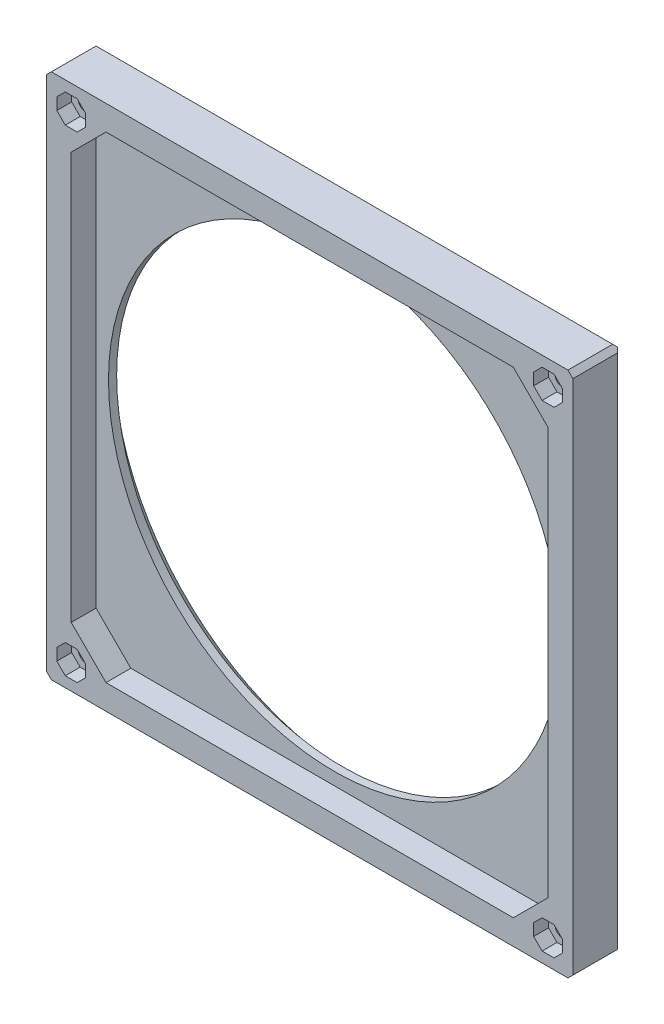
from build123d import *

# Parameters (mm, degrees)
SKETCH1_LARGER_DIA_W    = 106
SKETCH1_LARGER_DIA_H    = 106
BOSS_EXTRUDE1_DEPTH     = 5
SKETCH5_SMALLER_DIA_W   = 106
SKETCH5_SMALLER_DIA_H   = 106
SKETCH5_SMALLER_DIA_R   = 45.5
BOSS_EXTRUDE2_DEPTH     = 5
CUT_EXTRUDE1_DEPTH      = 3
CHAMFER1_SIZE           = 4
CHAMFER1_SIZE2          = 3.356398525
CHAMFER2_SIZE           = 1
CHAMFER3_SIZE           = 1
CUT_EXTRUDE2_DEPTH      = 10
CUT_EXTRUDE2_DEPTH_BACK = 2
SKETCH3_HOLES_R         = 1.6


with BuildPart() as part:
    # Sketch1 larger dia → Boss-Extrude1 (new body)
    with BuildSketch(Plane.XY):
        Rectangle(SKETCH1_LARGER_DIA_W, SKETCH1_LARGER_DIA_H)
        Polygon((-41, 48), (41, 48), (48, 41), (48, -41), (41, -48), (-41, -48), (-48, -41), (-48, 41), align=None, mode=Mode.SUBTRACT)
    extrude(amount=BOSS_EXTRUDE1_DEPTH)

    # Sketch5 smaller dia → Boss-Extrude2 (add)
    with BuildSketch(Plane(origin=(0, 0, 0), x_dir=(-1, 0, 0), z_dir=(0, 0, -1))):
        Rectangle(SKETCH5_SMALLER_DIA_W, SKETCH5_SMALLER_DIA_H)
        Circle(SKETCH5_SMALLER_DIA_R, mode=Mode.SUBTRACT)
    extrude(amount=BOSS_EXTRUDE2_DEPTH)

    # Sketch1 → Cut-Extrude1 (cut)
    with BuildSketch(Plane.XY.offset(5)):
        Polygon((-45.1, 46.798780669), (-45.1, 49.201219331), (-46.798780669, 50.9), (-49.201219331, 50.9), (-50.9, 49.201219331), (-50.9, 46.798780669), (-49.201219331, 45.1), (-46.798780669, 45.1), align=None)
        Polygon((-46.798780669, -45.1), (-45.1, -46.798780669), (-45.1, -49.201219331), (-46.798780669, -50.9), (-49.201219331, -50.9), (-50.9, -49.201219331), (-50.9, -46.798780669), (-49.201219331, -45.1), align=None)
        Polygon((46.798780669, 45.1), (45.1, 46.798780669), (45.1, 49.201219331), (46.798780669, 50.9), (49.201219331, 50.9), (50.9, 49.201219331), (50.9, 46.798780669), (49.201219331, 45.1), align=None)
        Polygon((45.1, -46.798780669), (45.1, -49.201219331), (46.798780669, -50.9), (49.201219331, -50.9), (50.9, -49.201219331), (50.9, -46.798780669), (49.201219331, -45.1), (46.798780669, -45.1), align=None)
    extrude(amount=-CUT_EXTRUDE1_DEPTH, mode=Mode.SUBTRACT)

    # Chamfer1
    chamfer1_edges = [part.edges().sort_by_distance(p)[0] for p in [
        (45.5, 0, -5),
    ]]
    chamfer1_side = [part.faces().sort_by_distance(p)[0] for p in [
        (0, 51.500933624, -5),
    ]]
    chamfer(chamfer1_edges, length=CHAMFER1_SIZE, length2=CHAMFER1_SIZE2, reference=chamfer1_side[0])

    # Chamfer2
    chamfer2_edges = [part.edges().sort_by_distance(p)[0] for p in [
        (53, 0, -5),
        (0, -53, -5),
        (-53, 0, -5),
        (0, 53, -5),
    ]]
    chamfer(chamfer2_edges, length=CHAMFER2_SIZE)

    # Chamfer3
    chamfer3_edges = [part.edges().sort_by_distance(p)[0] for p in [
        (-53, 53, 0.5),
        (53, 53, 0.5),
        (53, -53, 0.5),
        (-53, -53, 0.5),
    ]]
    chamfer(chamfer3_edges, length=CHAMFER3_SIZE)

    # Sketch3 holes → Cut-Extrude2 (cut, two sides: drawn at the far end of the back side and taken through both)
    with BuildSketch(Plane.XY.offset(-CUT_EXTRUDE2_DEPTH_BACK)):
        with Locations((-48, 48)):
            Circle(SKETCH3_HOLES_R)
        with Locations(Location((48, 48, 0), (0, 0, 180))):
            Circle(SKETCH3_HOLES_R)
        with Locations(Location((-48, -48, 0), (0, 0, 180))):
            Circle(SKETCH3_HOLES_R)
        with Locations((48, -48)):
            Circle(SKETCH3_HOLES_R)
    extrude(amount=CUT_EXTRUDE2_DEPTH + CUT_EXTRUDE2_DEPTH_BACK, mode=Mode.SUBTRACT)


solid = part.part
